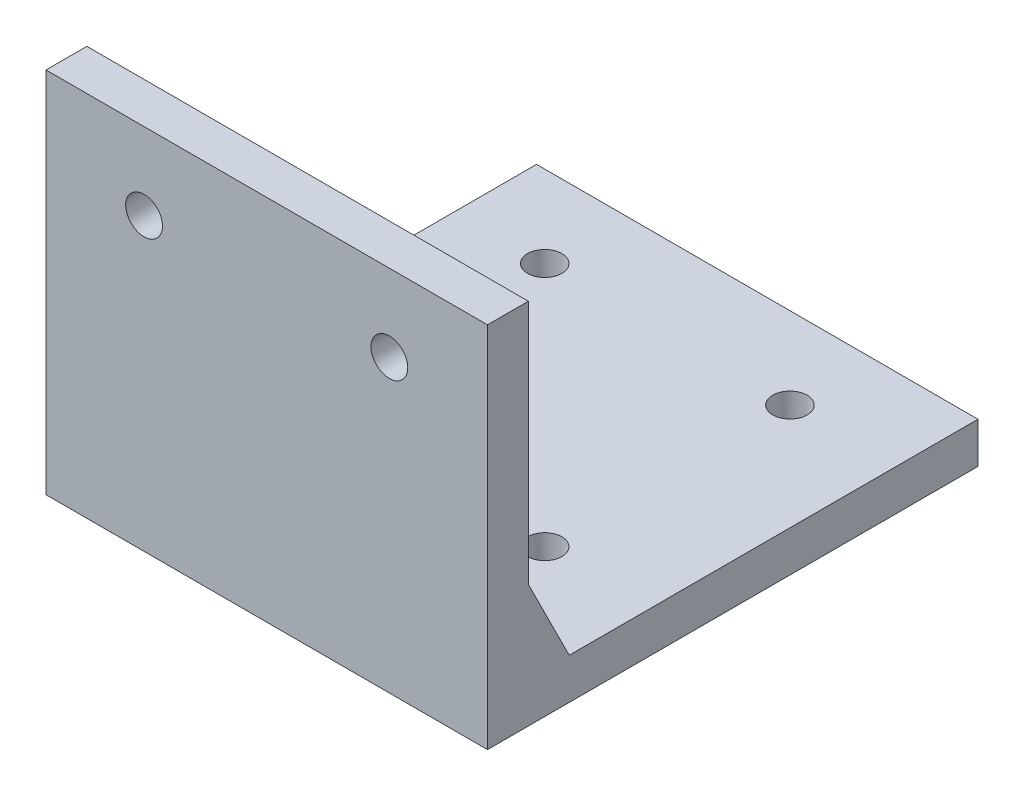
from build123d import *

# Parameters (mm, degrees)
SKETCH_1_W          = 60
SKETCH_1_H          = 45
EXTRUDE_2_DEPTH     = 54
SKETCH_4_W          = 55
SKETCH_4_H          = 40
CUT_EXTRUDE_3_DEPTH = 54
SKETCH_5_R          = 2.25
CUT_EXTRUDE_4_DEPTH = 27
SKETCH_6_R          = 2.1
CUT_EXTRUDE_5_DEPTH = 27
EXTRUDE_3_DEPTH     = 54


with BuildPart() as part:
    # 草图1 → 凸台-拉伸2 (new body)
    with BuildSketch(Plane(origin=(0, 0, 0), x_dir=(0, 0, -1), z_dir=(1, 0, 0))):
        with Locations((28.844429728, 4.579365776)):
            Rectangle(SKETCH_1_W, SKETCH_1_H)
    extrude(amount=EXTRUDE_2_DEPTH)

    # 草图4 → 切除-拉伸3 (cut)
    with BuildSketch(Plane(origin=(54, 0, 0), x_dir=(0, 0, -1), z_dir=(1, 0, 0))):
        with Locations((31.344429728, 7.079365776)):
            Rectangle(SKETCH_4_W, SKETCH_4_H)
    extrude(amount=-CUT_EXTRUDE_3_DEPTH, mode=Mode.SUBTRACT)

    # 草图5 → 切除-拉伸4 (cut, symmetric)
    with BuildSketch(Plane(origin=(0, 0, -3.844429728), x_dir=(-1, 0, 0), z_dir=(0, 0, -1))):
        with Locations(Location((-42, 17.653246287, 0), (0, 0, 180))):
            Circle(SKETCH_5_R)
        with Locations(Location((-12, 17.653246287, 0), (0, 0, 180))):
            Circle(SKETCH_5_R)
    extrude(amount=CUT_EXTRUDE_4_DEPTH, both=True, mode=Mode.SUBTRACT)

    # 草图6 → 切除-拉伸5 (cut, symmetric)
    with BuildSketch(Plane(origin=(0, -12.920634224, 0), x_dir=(1, 0, 0), z_dir=(0, 1, 0))):
        with Locations(Location((11, 48.844429728, 0), (0, 0, 270))):
            Circle(SKETCH_6_R)
        with Locations(Location((41, 48.844429728, 0), (0, 0, 270))):
            Circle(SKETCH_6_R)
        with Locations(Location((11, 18.844429728, 0), (0, 0, 270))):
            Circle(SKETCH_6_R)
        with Locations(Location((41, 18.844429728, 0), (0, 0, 270))):
            Circle(SKETCH_6_R)
    extrude(amount=CUT_EXTRUDE_5_DEPTH, both=True, mode=Mode.SUBTRACT)

    # 草图7 → 凸台-拉伸3 (add)
    with BuildSketch(Plane(origin=(54, 0, 0), x_dir=(0, 0, -1), z_dir=(1, 0, 0))):
        Polygon((3.844429728, -2.920634224), (8.844429728, -12.920634224), (3.844429728, -12.920634224), align=None)
    extrude(amount=-EXTRUDE_3_DEPTH)


solid = part.part
